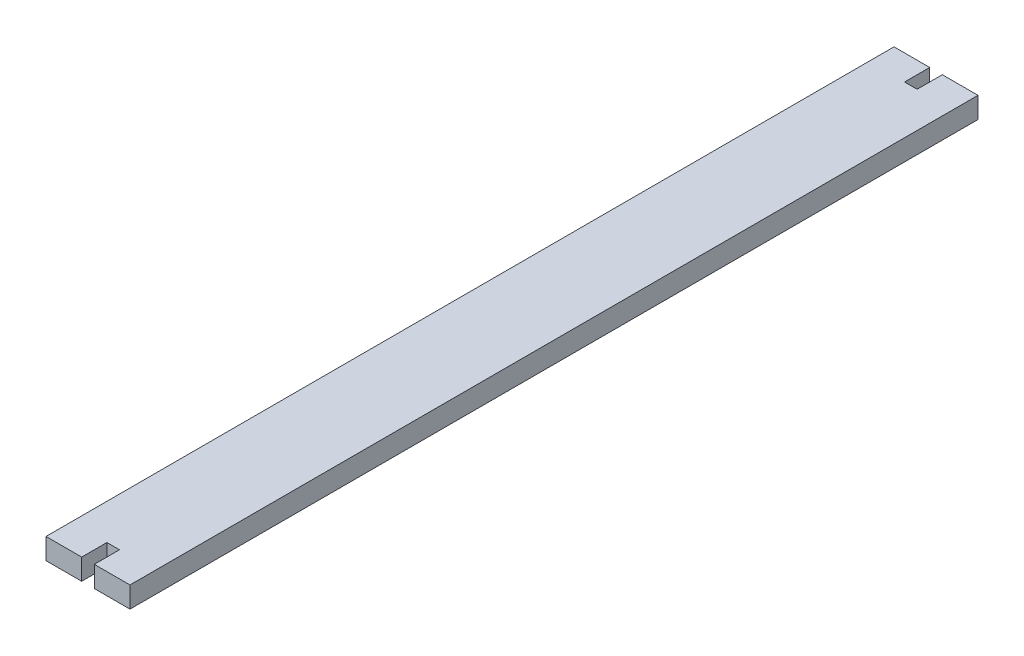
from build123d import *

# Parameters (mm, degrees)
SKETCH1_W           = 20
SKETCH1_H           = 202
BOSS_EXTRUDE1_DEPTH = 5
SKETCH2_W           = 3
SKETCH2_H           = 6
CUT_EXTRUDE1_DEPTH  = 102.616927724


with BuildPart() as part:
    # Sketch1 → Boss-Extrude1 (new body)
    with BuildSketch(Plane(origin=(0, 0, 0), x_dir=(1, 0, 0), z_dir=(0, 1, 0))):
        Rectangle(SKETCH1_W, SKETCH1_H)
    extrude(amount=-BOSS_EXTRUDE1_DEPTH)

    # Sketch2 → Cut-Extrude1 (cut, through all)
    with BuildSketch(Plane(origin=(0, 0, 0), x_dir=(1, 0, 0), z_dir=(0, 1, 0))):
        with Locations((0, -98)):
            Rectangle(SKETCH2_W, SKETCH2_H)
        with Locations((0, 98)):
            Rectangle(SKETCH2_W, SKETCH2_H)
    extrude(amount=-CUT_EXTRUDE1_DEPTH, mode=Mode.SUBTRACT)


solid = part.part
